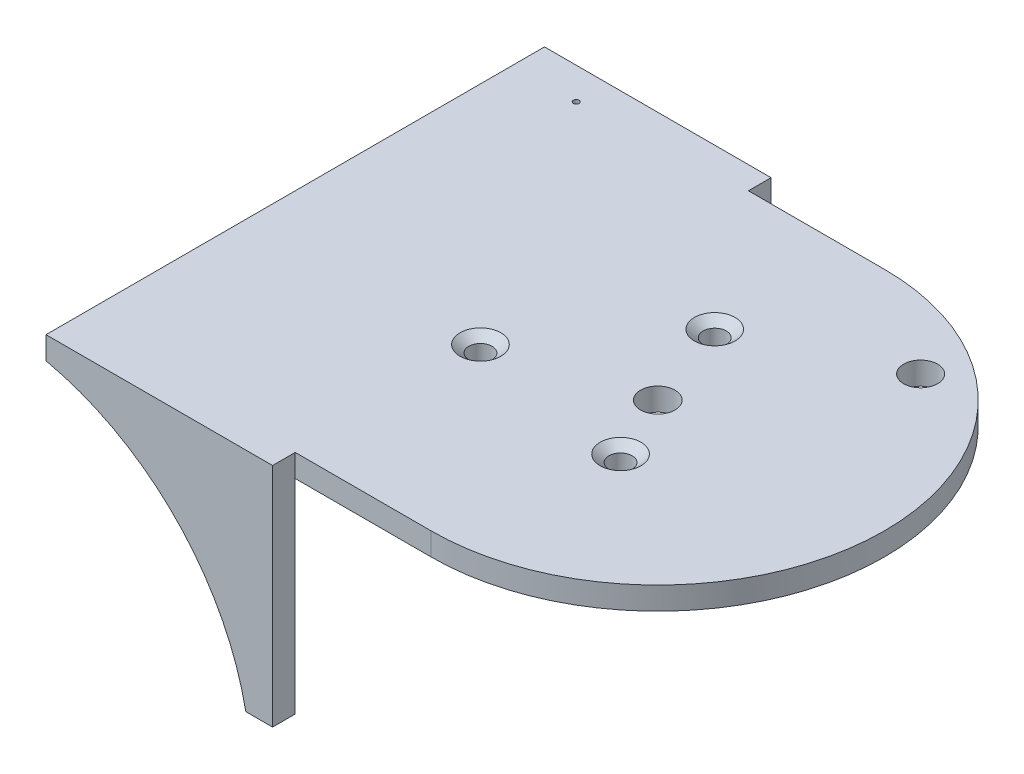
from build123d import *

# Parameters (mm, degrees)
BOSS_EXTRUDE1_DEPTH                               = 3.175
SKETCH2_R                                         = 2.413
SKETCH2_R_2                                       = 0.79375
CUT_EXTRUDE1_DEPTH                                = 60.989858518
CSK_FOR_4_FLAT_HEAD_MACHINE_SCREW_100_D           = 3.2639
CSK_FOR_4_FLAT_HEAD_MACHINE_SCREW_100_CSINK_D     = 5.715
CSK_FOR_4_FLAT_HEAD_MACHINE_SCREW_100_CSINK_ANGLE = 100
SKETCH5_R                                         = 2.38125
SKETCH5_R_2                                       = 0.396875
CUT_EXTRUDE2_DEPTH                                = 60.989858518
BOSS_EXTRUDE2_DEPTH                               = 3.175


with BuildPart() as part:
    # Sketch1 → Boss-Extrude1 (new body)
    with BuildSketch(Plane(origin=(0, 0, 0), x_dir=(1, 0, 0), z_dir=(0, 1, 0))):
        with BuildLine():
            Line((0, 31.75), (-50.8, 31.75))
            Line((-50.8, 31.75), (-50.8, -31.75))
            Line((-50.8, -31.75), (0, -31.75))
            ThreePointArc((0, -31.75), (31.75, 0), (0, 31.75))
        make_face()
    extrude(amount=BOSS_EXTRUDE1_DEPTH)

    # Sketch2 → Cut-Extrude1 (cut, through all)
    with BuildSketch(Plane(origin=(0, 3.175, 0), x_dir=(1, 0, 0), z_dir=(0, 1, 0))):
        with Locations(Location((0, 0, 0), (0, 0, 270))):
            Circle(SKETCH2_R)
        with Locations(Location((-19.165786135, -5.680153436, 0), (0, 0, 270))):
            Circle(SKETCH2_R_2)
        with Locations(Location((-4.607724074, 12.589841237, 0), (0, 0, 270))):
            Circle(SKETCH2_R_2)
        with Locations(Location((3.935524409, -9.152807674, 0), (0, 0, 270))):
            Circle(SKETCH2_R_2)
    extrude(amount=-CUT_EXTRUDE1_DEPTH, mode=Mode.SUBTRACT)

    # CSK for #4 Flat Head Machine Screw (100)1 (through all)
    with Locations(Plane(origin=(0, 3.175, 0), x_dir=(1, 0, 0), z_dir=(0, 1, 0))):
        with Locations((3.935524409, -9.152807674), (-19.165786135, -5.680153436), (-4.607724074, 12.589841237)):
            CounterSinkHole(CSK_FOR_4_FLAT_HEAD_MACHINE_SCREW_100_D / 2, CSK_FOR_4_FLAT_HEAD_MACHINE_SCREW_100_CSINK_D / 2, counter_sink_angle=CSK_FOR_4_FLAT_HEAD_MACHINE_SCREW_100_CSINK_ANGLE)

    # Sketch5 → Cut-Extrude2 (cut, through all)
    with BuildSketch(Plane(origin=(0, 3.175, 0), x_dir=(1, 0, 0), z_dir=(0, 1, 0))):
        with Locations(Location((15.24, 21.59, 0), (0, 0, 270))):
            Circle(SKETCH5_R)
        with Locations(Location((-41.91, 30.48, 0), (0, 0, 270))):
            Circle(SKETCH5_R_2)
    extrude(amount=-CUT_EXTRUDE2_DEPTH, mode=Mode.SUBTRACT)

    # Sketch6 → Boss-Extrude2 (add)
    with BuildSketch(Plane(origin=(0, 0, -31.75), x_dir=(-1, 0, 0), z_dir=(0, 0, -1))):
        with BuildLine():
            Line((50.8, 3.175), (19.05, 3.175))
            Line((19.05, 3.175), (19.05, -28.575))
            Line((19.05, -28.575), (22.799338861, -28.575))
            ThreePointArc((22.799338861, -28.575), (32.546509941, -10.119826243), (50.8, 0))
            Line((50.8, 0), (50.8, 3.175))
        make_face()
    boss_extrude2 = extrude(amount=BOSS_EXTRUDE2_DEPTH)

    # Mirror1: Boss-Extrude2 across plane
    add(boss_extrude2.mirror(Plane.XY))


solid = part.part
